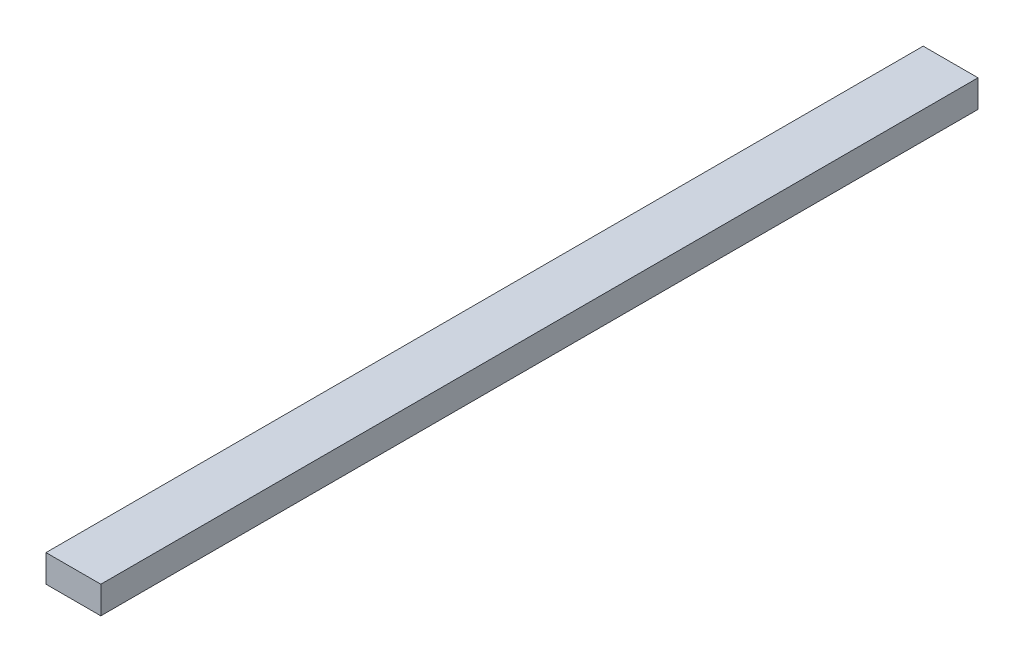
from build123d import *

# Parameters (mm, degrees)
SKETCH1_W           = 30
SKETCH1_H           = 15
BOSS_EXTRUDE1_DEPTH = 480


with BuildPart() as part:
    # Sketch1 → Boss-Extrude1 (new body)
    with BuildSketch(Plane.XY):
        Rectangle(SKETCH1_W, SKETCH1_H)
    extrude(amount=BOSS_EXTRUDE1_DEPTH)


solid = part.part
